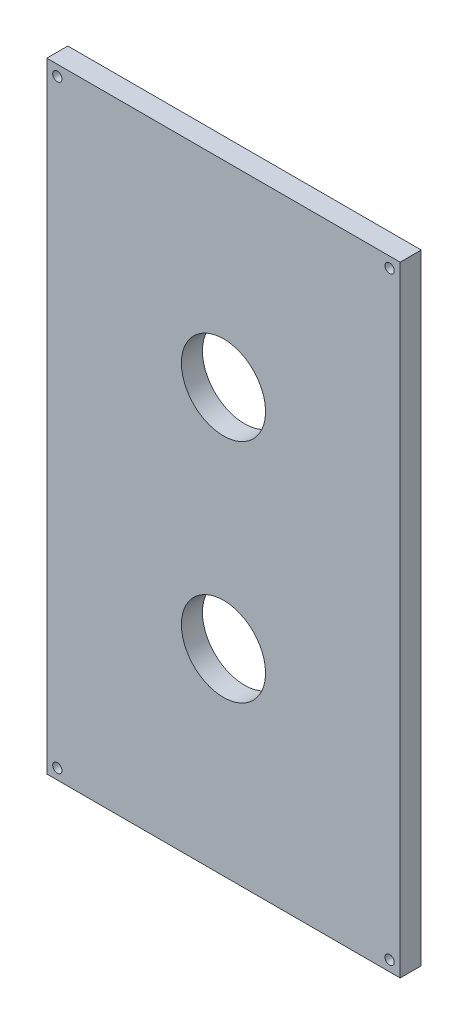
from build123d import *

# Parameters (mm, degrees)
SKETCH1_W                = 83.98
SKETCH1_H                = 147.35
PLATFORM_THICKNESS_DEPTH = 5
SKETCH2_R                = 10
IO_HOLE_1_DEPTH          = 170.675168778
SKETCH3_R                = 1.1
MOUNTING_HOLES_DEPTH     = 170.675168778


with BuildPart() as part:
    # Sketch1 → platform_thickness (new body)
    with BuildSketch(Plane.XY):
        with Locations((-41.99, 73.675)):
            Rectangle(SKETCH1_W, SKETCH1_H)
    extrude(amount=PLATFORM_THICKNESS_DEPTH)

    # Sketch2 → io_hole_1 (cut, through all)
    with BuildSketch(Plane(origin=(0, 0, 0), x_dir=(-1, 0, 0), z_dir=(0, 0, -1))):
        with Locations((41.99, 100.585)):
            Circle(SKETCH2_R)
        with Locations((41.99, 46.765)):
            Circle(SKETCH2_R)
    extrude(amount=-IO_HOLE_1_DEPTH, mode=Mode.SUBTRACT)

    # Sketch3 → mounting_holes (cut, through all)
    with BuildSketch(Plane(origin=(0, 0, 0), x_dir=(-1, 0, 0), z_dir=(0, 0, -1))):
        with Locations((2.5, 144.85)):
            Circle(SKETCH3_R)
        with Locations((81.48, 144.85)):
            Circle(SKETCH3_R)
        with Locations((81.48, 2.5)):
            Circle(SKETCH3_R)
        with Locations((2.5, 2.5)):
            Circle(SKETCH3_R)
    extrude(amount=-MOUNTING_HOLES_DEPTH, mode=Mode.SUBTRACT)


solid = part.part
